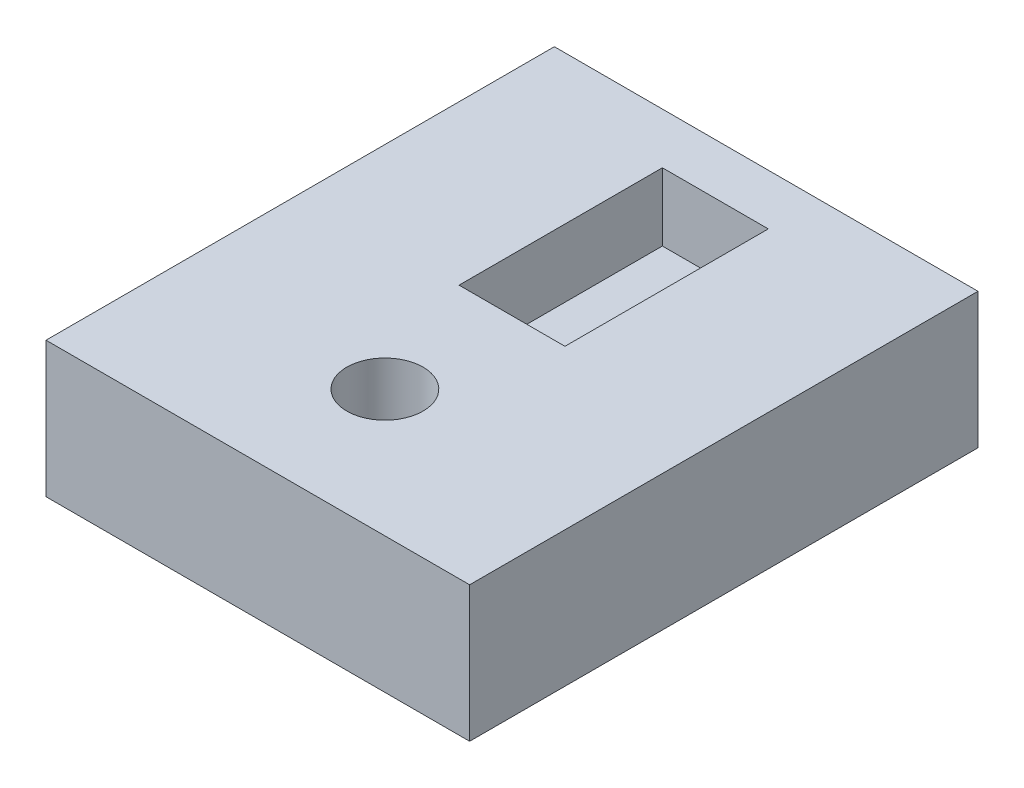
from build123d import *

# Parameters (mm, degrees)
SKETCH1_W            = 25
SKETCH1_H            = 8
BOSS_EXTRUDE1_DEPTH  = 15
SKETCH3_W            = 6.25
SKETCH3_H            = 4
CUT_EXTRUDE1_DEPTH   = 12
M4_CLEARANCE_HOLE1_D = 4.5


with BuildPart() as part:
    # Sketch1 → Boss-Extrude1 (new, symmetric)
    with BuildSketch(Plane.XY):
        Rectangle(SKETCH1_W, SKETCH1_H)
    extrude(amount=BOSS_EXTRUDE1_DEPTH, both=True)

    # Sketch3 → Cut-Extrude1 (cut)
    with BuildSketch(Plane(origin=(0, 0, -12), x_dir=(-1, 0, 0), z_dir=(0, 0, -1))):
        with Locations((0, 2)):
            Rectangle(SKETCH3_W, SKETCH3_H)
    extrude(amount=-CUT_EXTRUDE1_DEPTH, mode=Mode.SUBTRACT)

    # M4 Clearance Hole1 (through all)
    with Locations(Plane(origin=(0, -4, 0), x_dir=(-1, 0, 0), z_dir=(0, -1, 0))):
        with Locations((0, -7.5)):
            Hole(M4_CLEARANCE_HOLE1_D / 2)


solid = part.part
